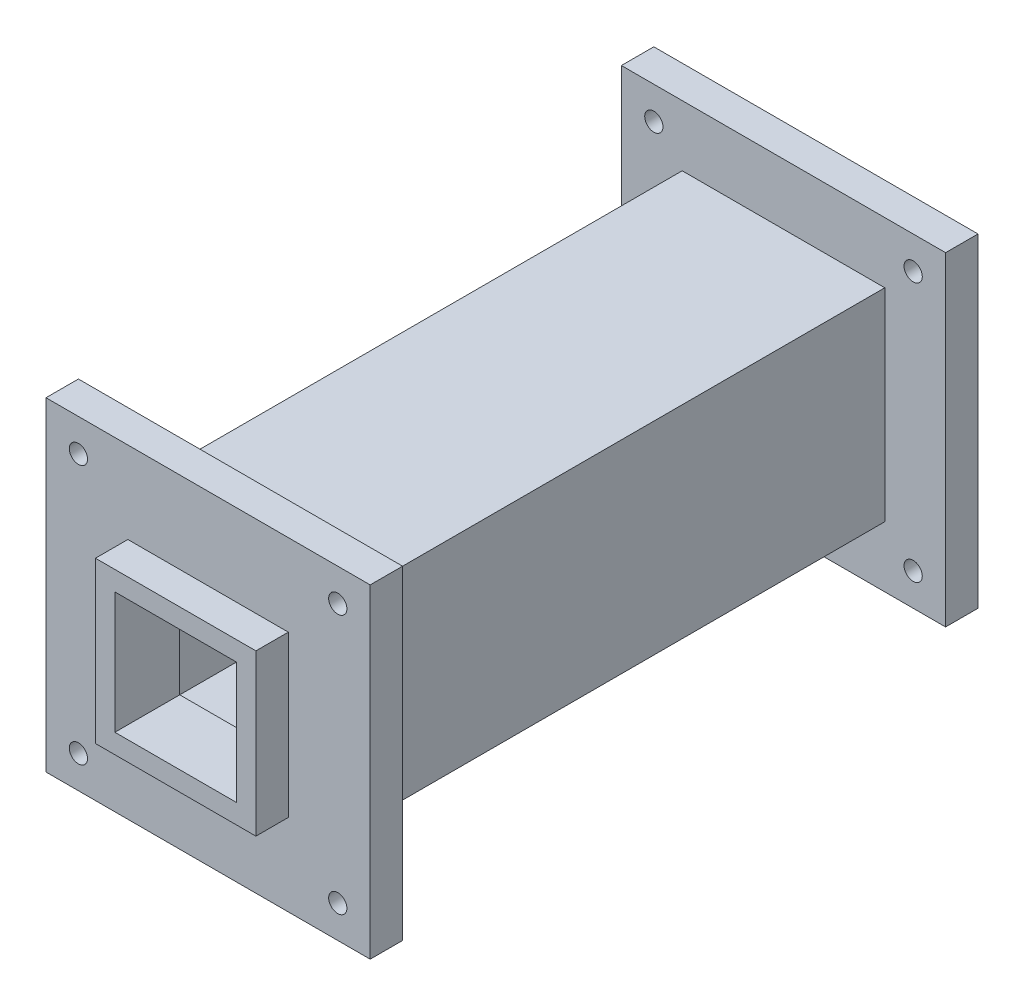
from build123d import *

# Parameters (mm, degrees)
SKETCH_1_W                = 50
SKETCH_1_H                = 50
SKETCH_1_W_2              = 40.4
SKETCH_1_H_2              = 40.4
EXTRUDE_50_4P8_DEPTH      = 150
SKETCH_2_W                = 80
SKETCH_2_H                = 80
SKETCH_2_W_2              = 40.4
SKETCH_2_H_2              = 40.4
EXTRUDE_379_DEPTH         = 8
EXTRUDE_START             = 142
SKETCH_3_W                = 80
SKETCH_3_H                = 80
SKETCH_3_W_2              = 30
SKETCH_3_H_2              = 30
EXTRUDE_483_DEPTH         = 8
EXTRUDE_START_2           = 150
SKETCH_4_W                = 39.6
SKETCH_4_H                = 39.6
SKETCH_4_W_2              = 30
SKETCH_4_H_2              = 30
EXTRUDE_39P6_DEPTH        = 8
CUT_EXTRUDE_M4_DEPTH      = 168.821333566
CUT_EXTRUDE_M4_DEPTH_BACK = 168.821333566
SKETCH_5_R                = 2.25


with BuildPart() as part:
    # 草图1 → 50方管壁厚4p8 (new body)
    with BuildSketch(Plane.XY):
        Rectangle(SKETCH_1_W, SKETCH_1_H)
        Rectangle(SKETCH_1_W_2, SKETCH_1_H_2, mode=Mode.SUBTRACT)
    extrude(amount=EXTRUDE_50_4P8_DEPTH)

    # 草图2 → Extrude 379 (add)
    with BuildSketch(Plane.XY):
        Rectangle(SKETCH_2_W, SKETCH_2_H)
        Rectangle(SKETCH_2_W_2, SKETCH_2_H_2, mode=Mode.SUBTRACT)
    extrude(amount=EXTRUDE_379_DEPTH)

    # 草图3 → Extrude 483 (add)
    with BuildSketch(Plane.XY.offset(EXTRUDE_START)):
        Rectangle(SKETCH_3_W, SKETCH_3_H)
        Rectangle(SKETCH_3_W_2, SKETCH_3_H_2, mode=Mode.SUBTRACT)
    extrude(amount=EXTRUDE_483_DEPTH)

    # 草图4 → 定位凸台39p6 (add)
    with BuildSketch(Plane.XY.offset(EXTRUDE_START_2)):
        Rectangle(SKETCH_4_W, SKETCH_4_H)
        Rectangle(SKETCH_4_W_2, SKETCH_4_H_2, mode=Mode.SUBTRACT)
    extrude(amount=EXTRUDE_39P6_DEPTH)

    # 草图5 → 四个M4法兰通孔 (cut, two sides: drawn at the far end of the back side and taken through both)
    with BuildSketch(Plane.XY.offset(-CUT_EXTRUDE_M4_DEPTH_BACK)):
        with Locations((-32, -32)):
            Circle(SKETCH_5_R)
        with Locations((-32, 32)):
            Circle(SKETCH_5_R)
        with Locations((32, -32)):
            Circle(SKETCH_5_R)
        with Locations((32, 32)):
            Circle(SKETCH_5_R)
    extrude(amount=CUT_EXTRUDE_M4_DEPTH + CUT_EXTRUDE_M4_DEPTH_BACK, mode=Mode.SUBTRACT)


solid = part.part
